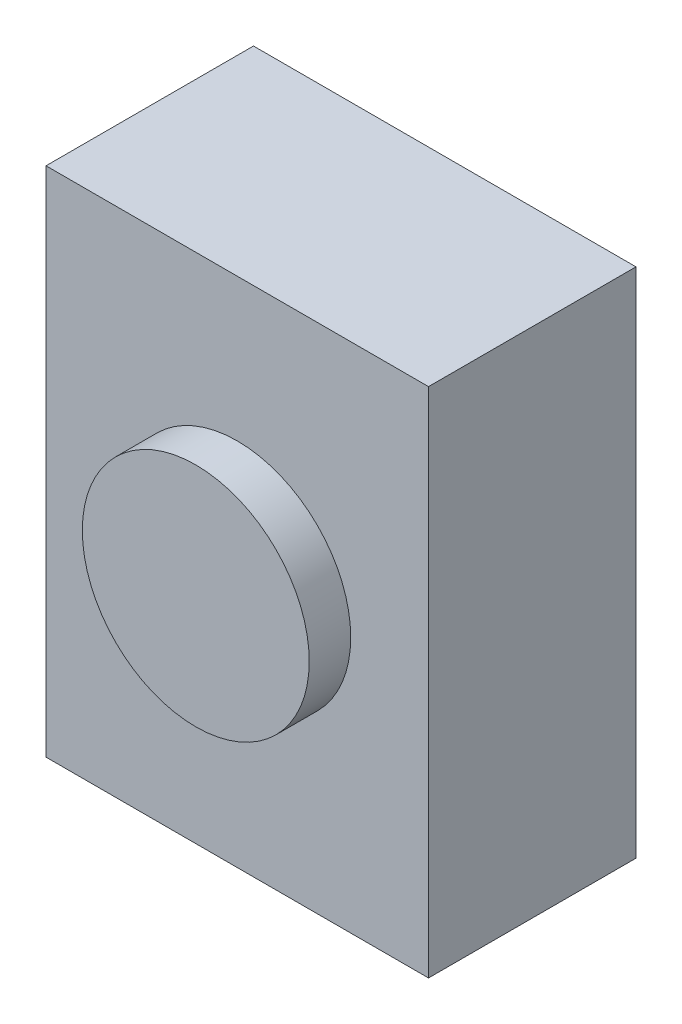
from build123d import *

# Parameters (mm, degrees)
SKETCH1_W           = 2.95
SKETCH1_H           = 3.95
BOSS_EXTRUDE1_DEPTH = 1.6
SKETCH2_R           = 0.875
BOSS_EXTRUDE2_DEPTH = 0.32


with BuildPart() as part:
    # Sketch1 → Boss-Extrude1 (new body)
    with BuildSketch(Plane.XY):
        Rectangle(SKETCH1_W, SKETCH1_H)
    extrude(amount=BOSS_EXTRUDE1_DEPTH)

    # Sketch2 → Boss-Extrude2 (add)
    with BuildSketch(Plane.XY.offset(1.6)):
        with Locations(Location((0, 0, 0), (0, 0, 180))):
            Circle(SKETCH2_R)
    extrude(amount=BOSS_EXTRUDE2_DEPTH)


solid = part.part
